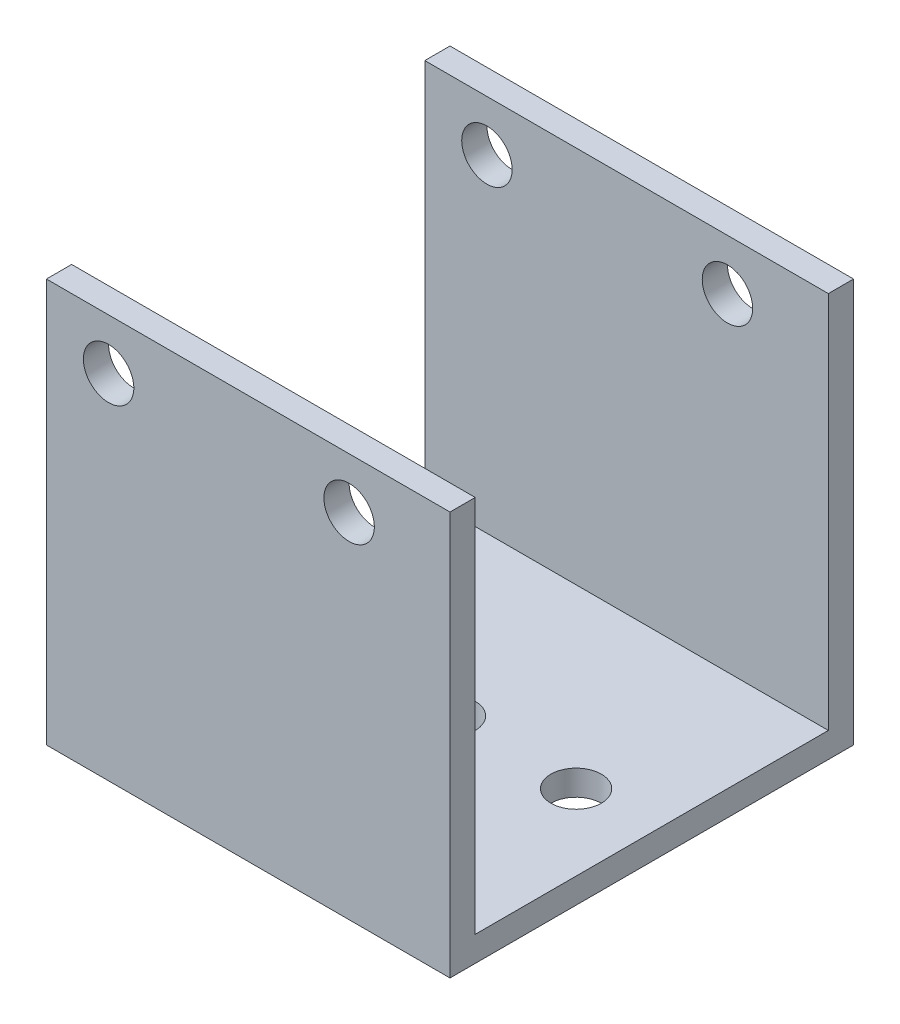
from build123d import *

# Parameters (mm, degrees)
BOSS_EXTRUDE1_DEPTH = 50.8
SKETCH2_R           = 3.175
CUT_EXTRUDE1_DEPTH  = 50.8
SKETCH6_R           = 3.175
CUT_EXTRUDE2_DEPTH  = 50.8


with BuildPart() as part:
    # Sketch1 → Boss-Extrude1 (new body)
    with BuildSketch(Plane(origin=(0, 0, 0), x_dir=(0, 0, -1), z_dir=(1, 0, 0))):
        Polygon((-29.265887299, 19.069791765), (-29.265887299, -31.730208235), (21.534112701, -31.730208235), (21.534112701, 19.069791765), (18.359112701, 19.069791765), (18.359112701, -28.555208235), (-26.090887299, -28.555208235), (-26.090887299, 19.069791765), align=None)
    extrude(amount=BOSS_EXTRUDE1_DEPTH)

    # Sketch2 → Cut-Extrude1 (cut)
    with BuildSketch(Plane(origin=(0, 0, -21.534112701), x_dir=(-1, 0, 0), z_dir=(0, 0, -1))):
        with Locations((-38.1, 12.680491765)):
            Circle(SKETCH2_R)
        with Locations((-7.8232, 12.680491765)):
            Circle(SKETCH2_R)
    extrude(amount=-CUT_EXTRUDE1_DEPTH, mode=Mode.SUBTRACT)

    # Sketch6 → Cut-Extrude2 (cut)
    with BuildSketch(Plane.XZ.offset(31.730208235)):
        with Locations(Location((41.275, 3.865887299, 0), (0, 0, 270))):
            Circle(SKETCH6_R)
        with Locations(Location((25.4, 3.865887299, 0), (0, 0, 270))):
            Circle(SKETCH6_R)
        with Locations(Location((9.525, 3.865887299, 0), (0, 0, 270))):
            Circle(SKETCH6_R)
    extrude(amount=-CUT_EXTRUDE2_DEPTH, mode=Mode.SUBTRACT)


solid = part.part
